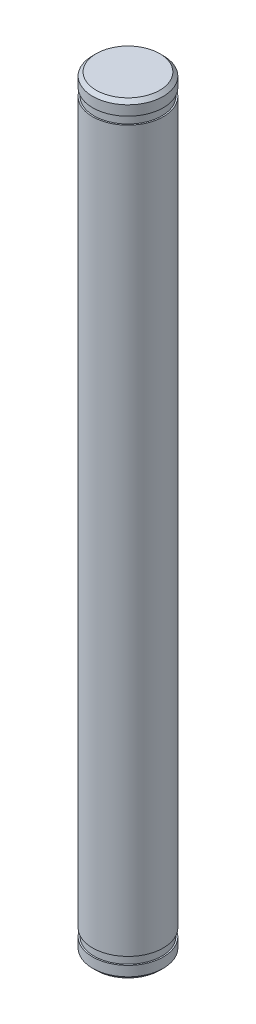
from build123d import *

# Parameters (mm, degrees)
SKETCH_1_R          = 5
EXTRUDE_1_DEPTH     = 108
CHAMFER_1_SIZE      = 0.5
CUT_EXTRUDE_START   = -3
SKETCH_2_R          = 5
SKETCH_2_R_2        = 4.8
CUT_EXTRUDE_1_DEPTH = 1.1


with BuildPart() as part:
    # 草图1 → 凸台-拉伸1 (new body)
    with BuildSketch(Plane(origin=(0, 0, 0), x_dir=(1, 0, 0), z_dir=(0, 1, 0))):
        with Locations(Location((0, 0, 0), (0, 0, 270))):
            Circle(SKETCH_1_R)
    extrude(amount=EXTRUDE_1_DEPTH)

    # 倒角1
    chamfer_1_edges = [part.edges().sort_by_distance(p)[0] for p in [
        (0, 0, -5),
        (0, 108, -5),
    ]]
    chamfer(chamfer_1_edges, length=CHAMFER_1_SIZE)

    # 草图2 → 切除-拉伸1 (cut)
    with BuildSketch(Plane(origin=(0, 108, 0), x_dir=(1, 0, 0), z_dir=(0, 1, 0)).offset(CUT_EXTRUDE_START)):
        with Locations(Location((0, 0, 0), (0, 0, 270))):
            Circle(SKETCH_2_R)
        with Locations(Location((0, 0, 0), (0, 0, 270))):
            Circle(SKETCH_2_R_2, mode=Mode.SUBTRACT)
    cut_extrude_1 = extrude(amount=CUT_EXTRUDE_1_DEPTH, mode=Mode.SUBTRACT)

    # 镜向1: 切除-拉伸1 across plane
    add(cut_extrude_1.mirror(Plane.ZX.offset(54)), mode=Mode.SUBTRACT)


solid = part.part
